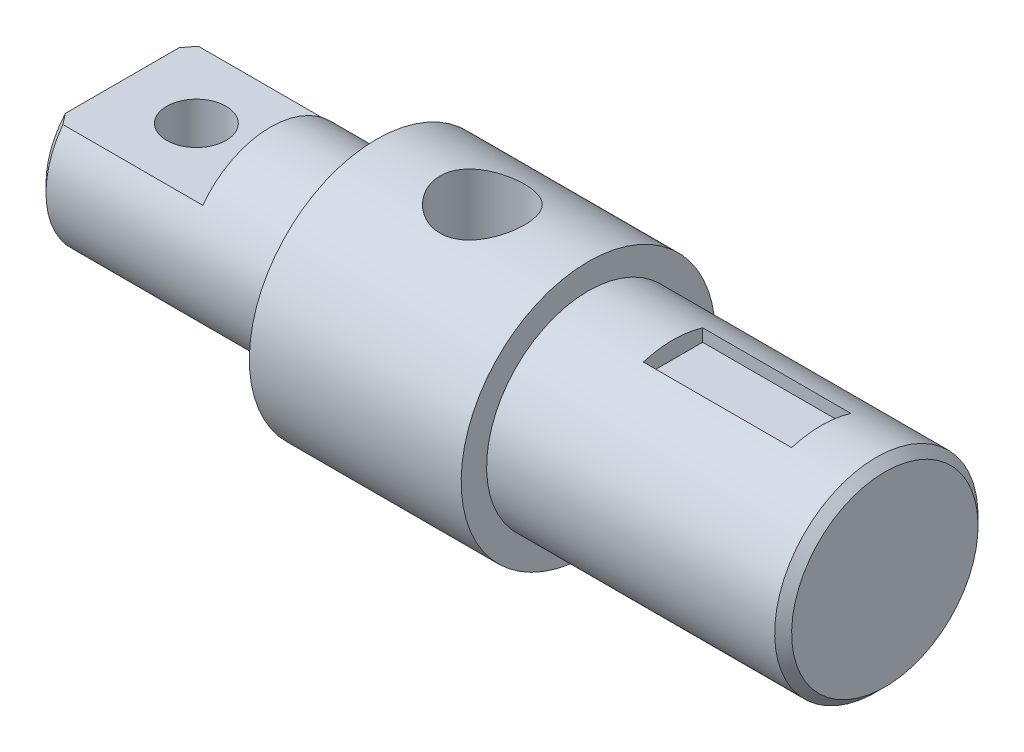
from build123d import *

# Parameters (mm, degrees)
CUT_EXTRUDE_START        = -35
CUT_EXTRUDE_1_DEPTH      = 35
CUT_EXTRUDE_2_DEPTH      = 185.932420089
CUT_EXTRUDE_2_DEPTH_BACK = 185.932420089
SKETCH_4_R               = 7
SKETCH_4_R_2             = 10
SKETCH_5_W               = 35
SKETCH_5_H               = 14
CUT_EXTRUDE_3_DEPTH      = 4
CHAMFER_1_SIZE           = 2


with BuildPart() as part:
    # Эскиз2 → Повернуть1 (revolve)
    with BuildSketch(Plane.XY):
        Polygon((0, 0), (0, 20), (60, 20), (60, 30), (110, 30), (110, 24), (180, 24), (180, 0), align=None)
    revolve(axis=Axis((180, 0, 0), (-1, 0, 0)))

    # Эскиз3 → Вырез-Вытянуть1 (cut)
    with BuildSketch(Plane.ZY.offset(CUT_EXTRUDE_START)):
        with BuildLine():
            Line((-16, 12), (16, 12))
            ThreePointArc((16, 12), (0, 20), (-16, 12))
        make_face()
    extrude(amount=CUT_EXTRUDE_1_DEPTH, mode=Mode.SUBTRACT)

    # Эскиз4 → Вырез-Вытянуть2 (cut, two sides: drawn at the far end of the back side and taken through both)
    with BuildSketch(Plane(origin=(0, 0, 0), x_dir=(1, 0, 0), z_dir=(0, 1, 0)).offset(-CUT_EXTRUDE_2_DEPTH_BACK)):
        with Locations(Location((17.5, 0, 0), (0, 0, 270))):
            Circle(SKETCH_4_R)
        with Locations(Location((85, 0, 0), (0, 0, 270))):
            Circle(SKETCH_4_R_2)
    extrude(amount=CUT_EXTRUDE_2_DEPTH + CUT_EXTRUDE_2_DEPTH_BACK, mode=Mode.SUBTRACT)

    # Эскиз5 → Вырез-Вытянуть3 (cut)
    with BuildSketch(Plane(origin=(0, 24, 0), x_dir=(1, 0, 0), z_dir=(0, 1, 0))):
        with Locations((147.5, 0)):
            Rectangle(SKETCH_5_W, SKETCH_5_H)
    extrude(amount=-CUT_EXTRUDE_3_DEPTH, mode=Mode.SUBTRACT)

    # Фаска1
    chamfer_1_edges = [part.edges().sort_by_distance(p)[0] for p in [
        (180, -24, 0),
        (0, -20, 0),
    ]]
    chamfer(chamfer_1_edges, length=CHAMFER_1_SIZE)


solid = part.part
